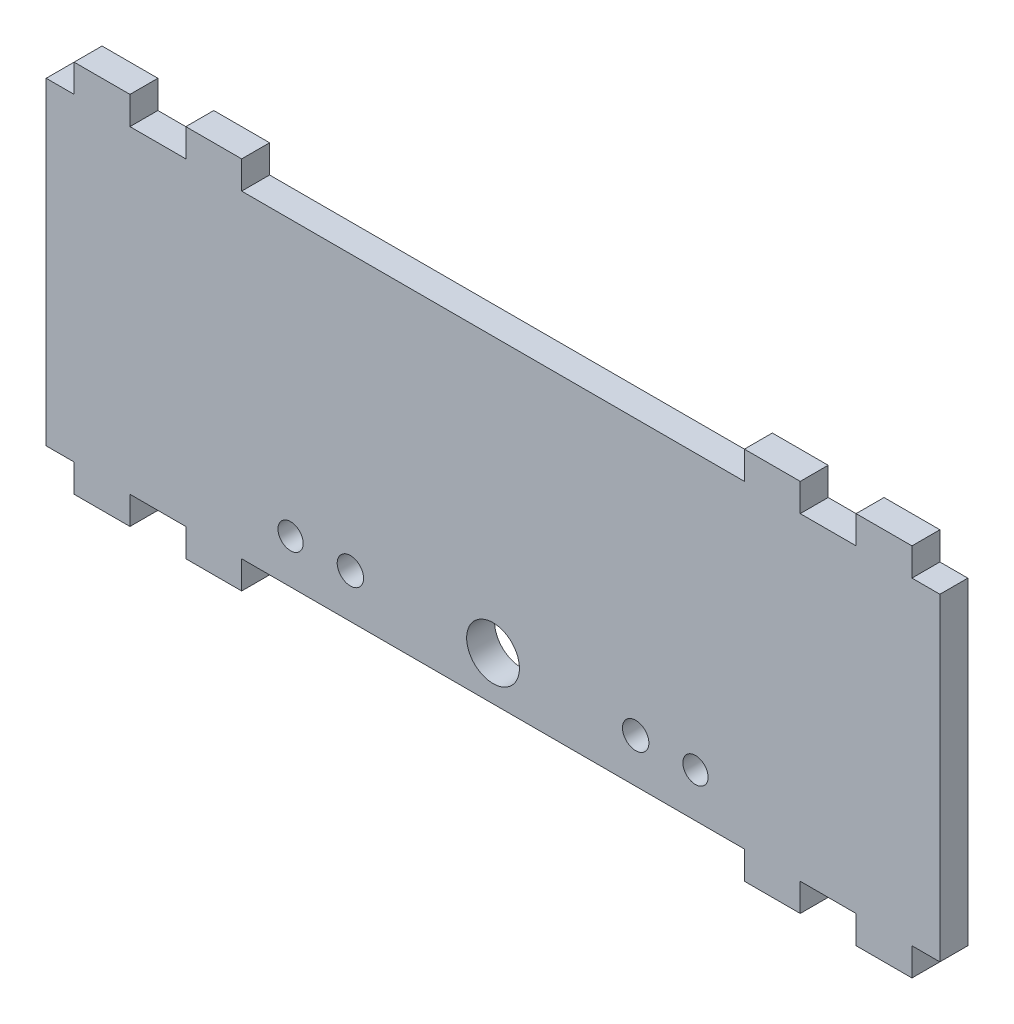
from build123d import *

# Parameters (mm, degrees)
SKETCH1_R           = 1.5
SKETCH1_R_2         = 1.435
SKETCH1_R_3         = 3
BOSS_EXTRUDE1_DEPTH = 3.175


with BuildPart() as part:
    # Sketch1 → Boss-Extrude1 (new body)
    with BuildSketch(Plane.XY):
        Polygon((3.175, 0), (3.175, -3.175), (9.525, -3.175), (9.525, 0), (15.875, 0), (15.875, -3.175), (22.225, -3.175), (22.225, 0), (79.375, 0), (79.375, -3.175), (85.725, -3.175), (85.725, 0), (92.075, 0), (92.075, -3.175), (98.425, -3.175), (98.425, 0), (101.6, 0), (101.6, 36.195), (98.425, 36.195), (98.425, 39.37), (92.075, 39.37), (92.075, 36.195), (85.725, 36.195), (85.725, 39.37), (79.375, 39.37), (79.375, 36.195), (22.225, 36.195), (22.225, 39.37), (15.875, 39.37), (15.875, 36.195), (9.525, 36.195), (9.525, 39.37), (3.175, 39.37), (3.175, 36.195), (0, 36.195), (0, 0), align=None)
        with Locations((34.585, 5)):
            Circle(SKETCH1_R, mode=Mode.SUBTRACT)
        with Locations((27.7875, 5)):
            Circle(SKETCH1_R_2, mode=Mode.SUBTRACT)
        with Locations(Location((67.015, 5, 0), (0, 0, 180))):
            Circle(SKETCH1_R, mode=Mode.SUBTRACT)
        with Locations(Location((73.8125, 5, 0), (0, 0, 180))):
            Circle(SKETCH1_R_2, mode=Mode.SUBTRACT)
        with Locations((50.8, 5)):
            Circle(SKETCH1_R_3, mode=Mode.SUBTRACT)
    extrude(amount=BOSS_EXTRUDE1_DEPTH)


solid = part.part
